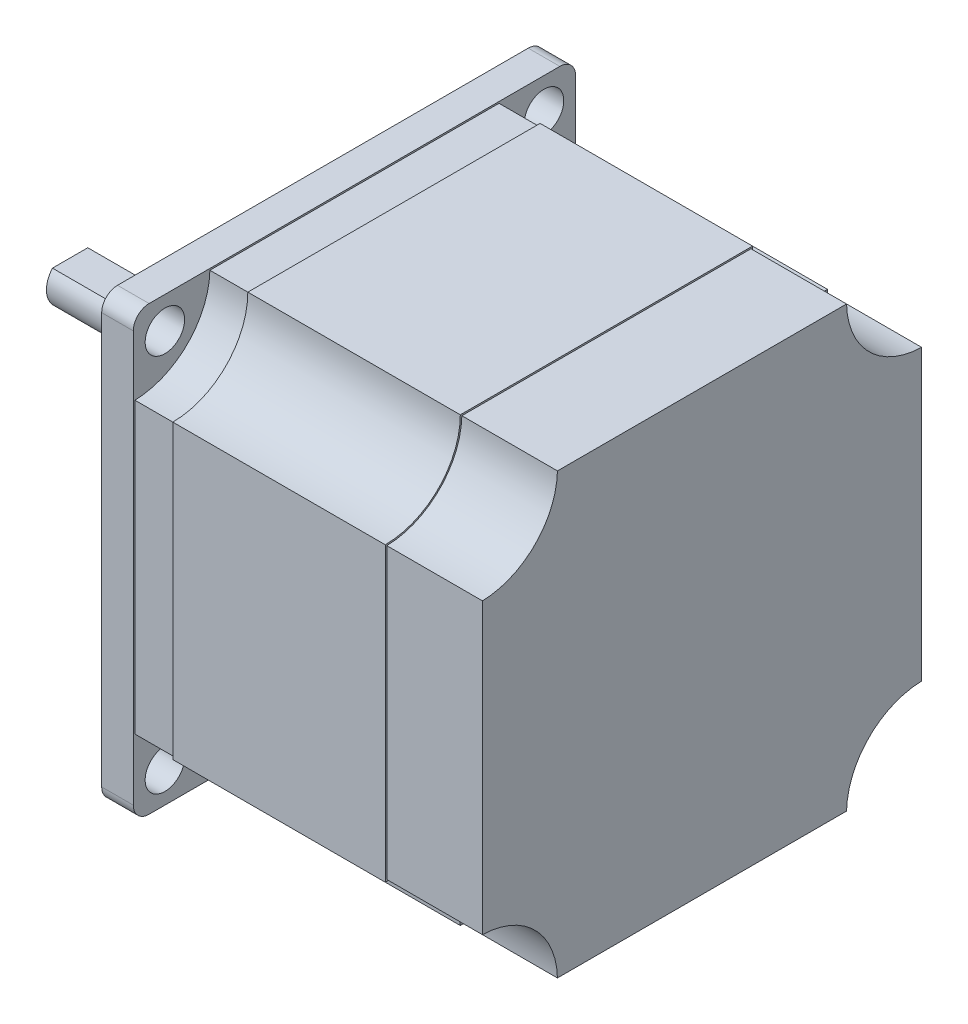
from build123d import *

# Parameters (mm, degrees)
SKETCH1_R           = 3
BOSS_EXTRUDE1_DEPTH = 27
CUT_EXTRUDE4_START  = -0.1
CUT_EXTRUDE4_DEPTH  = 0.1
BOSS_EXTRUDE4_DEPTH = 12
BOSS_EXTRUDE5_START = 5
BOSS_EXTRUDE5_DEPTH = 5
SKETCH14_R          = 2.5
BOSS_EXTRUDE7_DEPTH = 4
SKETCH15_R          = 19
BOSS_EXTRUDE8_DEPTH = 2
BOSS_EXTRUDE9_START = 30
SKETCH16_R          = 3
BOSS_EXTRUDE9_DEPTH = 30
SKETCH17_W          = 6
SKETCH17_H          = 6
CUT_EXTRUDE5_DEPTH  = 20


with BuildPart() as part:
    # Sketch1 → Boss-Extrude1 (new body)
    with BuildSketch(Plane(origin=(0, 0, 0), x_dir=(0, 0, -1), z_dir=(1, 0, 0))):
        with BuildLine():
            Line((-18.5, 28), (18.5, 28))
            ThreePointArc((18.5, 28), (21.282485579, 21.282485579), (28, 18.5))
            Line((28, 18.5), (28, -18.5))
            ThreePointArc((28, -18.5), (21.282485579, -21.282485579), (18.5, -28))
            Line((18.5, -28), (-18.5, -28))
            ThreePointArc((-18.5, -28), (-21.282485579, -21.282485579), (-28, -18.5))
            Line((-28, -18.5), (-28, 18.5))
            ThreePointArc((-28, 18.5), (-21.282485579, 21.282485579), (-18.5, 28))
        make_face()
        Circle(SKETCH1_R, mode=Mode.SUBTRACT)
    extrude(amount=BOSS_EXTRUDE1_DEPTH)

    # Sketch6 → Cut-Extrude4 (cut)
    with BuildSketch(Plane(origin=(27, 0, 0), x_dir=(0, 0, -1), z_dir=(1, 0, 0)).offset(CUT_EXTRUDE4_START)):
        with BuildLine():
            Line((28, -18.5), (28, 18.5))
            ThreePointArc((28, 18.5), (21.282485579, 21.282485579), (18.5, 28))
            Line((18.5, 28), (-18.5, 28))
            ThreePointArc((-18.5, 28), (-21.282485579, 21.282485579), (-28, 18.5))
            Line((-28, 18.5), (-28, -18.5))
            ThreePointArc((-28, -18.5), (-21.282485579, -21.282485579), (-18.5, -28))
            Line((-18.5, -28), (18.5, -28))
            ThreePointArc((18.5, -28), (21.282485579, -21.282485579), (28, -18.5))
        make_face()
        with BuildLine():
            Line((18.302062075, 27.8), (-18.302062075, 27.8))
            ThreePointArc((-18.302062075, 27.8), (-21.141064222, 21.141064222), (-27.8, 18.302062075))
            Line((-27.8, 18.302062075), (-27.8, -18.302062075))
            ThreePointArc((-27.8, -18.302062075), (-21.141064222, -21.141064222), (-18.302062075, -27.8))
            Line((-18.302062075, -27.8), (18.302062075, -27.8))
            ThreePointArc((18.302062075, -27.8), (21.141064222, -21.141064222), (27.8, -18.302062075))
            Line((27.8, -18.302062075), (27.8, 18.302062075))
            ThreePointArc((27.8, 18.302062075), (21.141064222, 21.141064222), (18.302062075, 27.8))
        make_face(mode=Mode.SUBTRACT)
    extrude(amount=CUT_EXTRUDE4_DEPTH, mode=Mode.SUBTRACT)

    # Sketch10 → Boss-Extrude4 (add)
    with BuildSketch(Plane(origin=(27, 0, 0), x_dir=(0, 0, -1), z_dir=(1, 0, 0))):
        with BuildLine():
            Line((27.8, -18.302062075), (27.8, 18.302062075))
            ThreePointArc((27.8, 18.302062075), (21.141064222, 21.141064222), (18.302062075, 27.8))
            Line((18.302062075, 27.8), (-18.302062075, 27.8))
            ThreePointArc((-18.302062075, 27.8), (-21.141064222, 21.141064222), (-27.8, 18.302062075))
            Line((-27.8, 18.302062075), (-27.8, -18.302062075))
            ThreePointArc((-27.8, -18.302062075), (-21.141064222, -21.141064222), (-18.302062075, -27.8))
            Line((-18.302062075, -27.8), (18.302062075, -27.8))
            ThreePointArc((18.302062075, -27.8), (21.141064222, -21.141064222), (27.8, -18.302062075))
        make_face()
    extrude(amount=BOSS_EXTRUDE4_DEPTH)

    # Sketch12 → Boss-Extrude5 (add)
    with BuildSketch(Plane.ZY.offset(BOSS_EXTRUDE5_START)):
        with BuildLine():
            Line((-27.8, 18.302062075), (-27.8, -18.302062075))
            ThreePointArc((-27.8, -18.302062075), (-21.141064222, -21.141064222), (-18.302062075, -27.8))
            Line((-18.302062075, -27.8), (18.302062075, -27.8))
            ThreePointArc((18.302062075, -27.8), (21.141064222, -21.141064222), (27.8, -18.302062075))
            Line((27.8, -18.302062075), (27.8, 18.302062075))
            ThreePointArc((27.8, 18.302062075), (21.141064222, 21.141064222), (18.302062075, 27.8))
            Line((18.302062075, 27.8), (-18.302062075, 27.8))
            ThreePointArc((-18.302062075, 27.8), (-21.141064222, 21.141064222), (-27.8, 18.302062075))
        make_face()
    extrude(amount=-BOSS_EXTRUDE5_DEPTH)

    # Sketch14 → Boss-Extrude7 (add)
    with BuildSketch(Plane.ZY.offset(5)):
        with BuildLine():
            Line((-26, 28), (26, 28))
            ThreePointArc((26, 28), (27.414213562, 27.414213562), (28, 26))
            Line((28, 26), (28, -26))
            ThreePointArc((28, -26), (27.414213562, -27.414213562), (26, -28))
            Line((26, -28), (-26, -28))
            ThreePointArc((-26, -28), (-27.414213562, -27.414213562), (-28, -26))
            Line((-28, -26), (-28, 26))
            ThreePointArc((-28, 26), (-27.414213562, 27.414213562), (-26, 28))
        make_face()
        with Locations((-24, 24)):
            Circle(SKETCH14_R, mode=Mode.SUBTRACT)
        with Locations((24, 24)):
            Circle(SKETCH14_R, mode=Mode.SUBTRACT)
        with Locations((24, -24)):
            Circle(SKETCH14_R, mode=Mode.SUBTRACT)
        with Locations((-24, -24)):
            Circle(SKETCH14_R, mode=Mode.SUBTRACT)
    extrude(amount=BOSS_EXTRUDE7_DEPTH)

    # Sketch15 → Boss-Extrude8 (add)
    with BuildSketch(Plane.ZY.offset(9)):
        Circle(SKETCH15_R)
    extrude(amount=BOSS_EXTRUDE8_DEPTH)

    # Sketch16 → Boss-Extrude9 (add)
    with BuildSketch(Plane.ZY.offset(11).offset(BOSS_EXTRUDE9_START)):
        Circle(SKETCH16_R)
    extrude(amount=-BOSS_EXTRUDE9_DEPTH)

    # Sketch17 → Cut-Extrude5 (cut)
    with BuildSketch(Plane.ZY.offset(41)):
        with Locations((0, 5)):
            Rectangle(SKETCH17_W, SKETCH17_H)
    extrude(amount=-CUT_EXTRUDE5_DEPTH, mode=Mode.SUBTRACT)


solid = part.part
